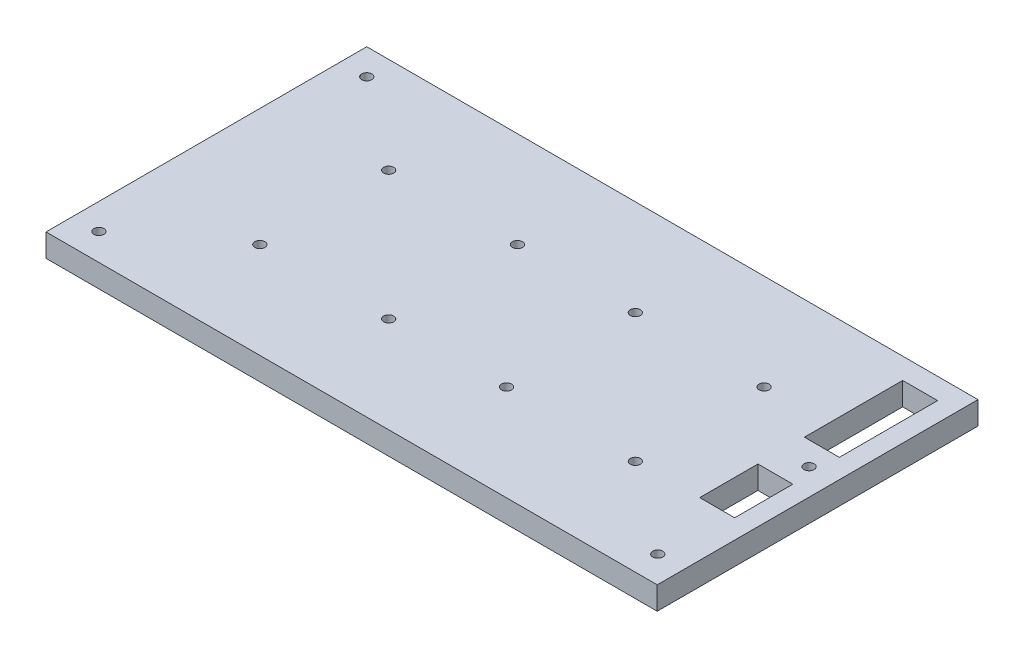
from build123d import *

# Parameters (mm, degrees)
SKETCH1_W                   = 133.35
SKETCH1_H                   = 69.98
PLATFORM_THICKNESS_DEPTH    = 5
SKETCH2_R                   = 1.1
MOUNTING_HOLES_1_DEPTH      = 151.679868927
SKETCH4_R                   = 1.1
MOUNTING_HOLES_2_DEPTH      = 151.679868927
SKETCH3_W                   = 7.62
SKETCH3_H                   = 12.7
SKETCH3_H_2                 = 21.44
CABLE_MANAGEMENT_HOLE_DEPTH = 151.679868927


with BuildPart() as part:
    # Sketch1 → platform_thickness (new body)
    with BuildSketch(Plane(origin=(0, 0, 0), x_dir=(1, 0, 0), z_dir=(0, 1, 0))):
        with Locations((-66.675, 34.99)):
            Rectangle(SKETCH1_W, SKETCH1_H)
    extrude(amount=PLATFORM_THICKNESS_DEPTH)

    # Sketch2 → mounting_holes_1 (cut, through all)
    with BuildSketch(Plane(origin=(0, 5, 0), x_dir=(1, 0, 0), z_dir=(0, 1, 0))):
        with Locations(Location((-5.75, 38.88, 0), (0, 0, 270))):
            Circle(SKETCH2_R)
        with Locations(Location((-5.75, 5.86, 0), (0, 0, 270))):
            Circle(SKETCH2_R)
        with Locations(Location((-127.67, 5.86, 0), (0, 0, 270))):
            Circle(SKETCH2_R)
        with Locations(Location((-127.67, 64.29, 0), (0, 0, 270))):
            Circle(SKETCH2_R)
    extrude(amount=-MOUNTING_HOLES_1_DEPTH, mode=Mode.SUBTRACT)

    # Sketch4 → mounting_holes_2 (cut, through all)
    with BuildSketch(Plane(origin=(0, 5, 0), x_dir=(1, 0, 0), z_dir=(0, 1, 0))):
        with Locations(Location((-25.716666667, 49.04, 0), (0, 0, 270))):
            Circle(SKETCH4_R)
        with Locations(Location((-25.716666667, 20.94, 0), (0, 0, 270))):
            Circle(SKETCH4_R)
        with Locations(Location((-53.816666667, 49.04, 0), (0, 0, 270))):
            Circle(SKETCH4_R)
        with Locations(Location((-53.816666667, 20.94, 0), (0, 0, 270))):
            Circle(SKETCH4_R)
        with Locations(Location((-79.533333333, 49.04, 0), (0, 0, 270))):
            Circle(SKETCH4_R)
        with Locations(Location((-79.533333333, 20.94, 0), (0, 0, 270))):
            Circle(SKETCH4_R)
        with Locations(Location((-107.633333333, 49.04, 0), (0, 0, 270))):
            Circle(SKETCH4_R)
        with Locations(Location((-107.633333333, 20.94, 0), (0, 0, 270))):
            Circle(SKETCH4_R)
    extrude(amount=-MOUNTING_HOLES_2_DEPTH, mode=Mode.SUBTRACT)

    # Sketch3 → cable_management_hole (cut, through all)
    with BuildSketch(Plane(origin=(0, 5, 0), x_dir=(1, 0, 0), z_dir=(0, 1, 0))):
        with Locations((-8.03, 27.46)):
            Rectangle(SKETCH3_W, SKETCH3_H)
        with Locations((-8.03, 54.67)):
            Rectangle(SKETCH3_W, SKETCH3_H_2)
    extrude(amount=-CABLE_MANAGEMENT_HOLE_DEPTH, mode=Mode.SUBTRACT)


solid = part.part
